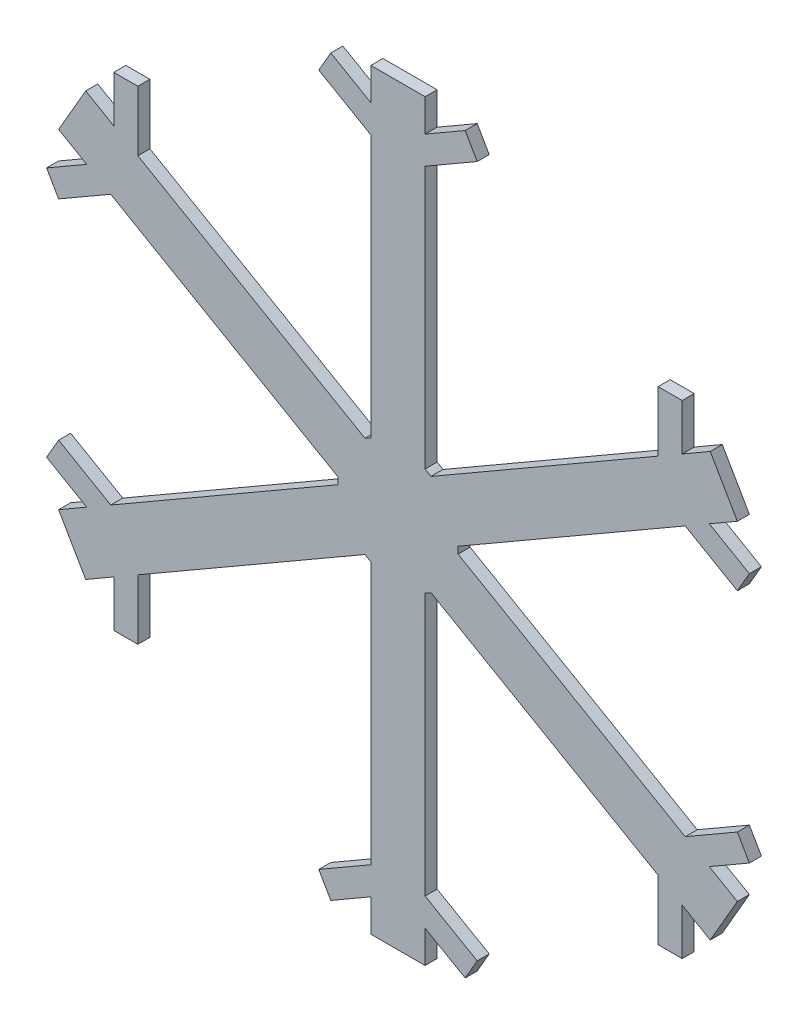
from build123d import *

# Parameters (mm, degrees)
SKETCH2_R           = 50
BOSS_EXTRUDE1_DEPTH = 10
BOSS_EXTRUDE2_DEPTH = 10
CIRPATTERN1_COUNT   = 6


with BuildPart() as part:
    # Sketch2 → Boss-Extrude1 (new body)
    with BuildSketch(Plane.XY):
        Circle(SKETCH2_R)
    extrude(amount=-BOSS_EXTRUDE1_DEPTH)

    # Sketch3 → Boss-Extrude2 (add)
    with BuildSketch(Plane.XY):
        Polygon((-22.5, 262.5), (-22.5, 0), (0, 0), (22.5, 0), (22.5, 262.5), (65.801270189, 287.5), (55.801270189, 304.820508076), (22.5, 285.594010768), (22.5, 312.5), (-22.5, 312.5), (-22.5, 285.594010768), (-55.801270189, 304.820508076), (-65.801270189, 287.5), align=None)
    boss_extrude2 = extrude(amount=-BOSS_EXTRUDE2_DEPTH)

    # CirPattern1: Boss-Extrude2 ×6 about axis
    cirpattern1_axis = Axis((0, 0, 0), (0, 0, 1))
    for i in range(1, CIRPATTERN1_COUNT):
        add(boss_extrude2.rotate(cirpattern1_axis, i * 360 / CIRPATTERN1_COUNT))


solid = part.part
